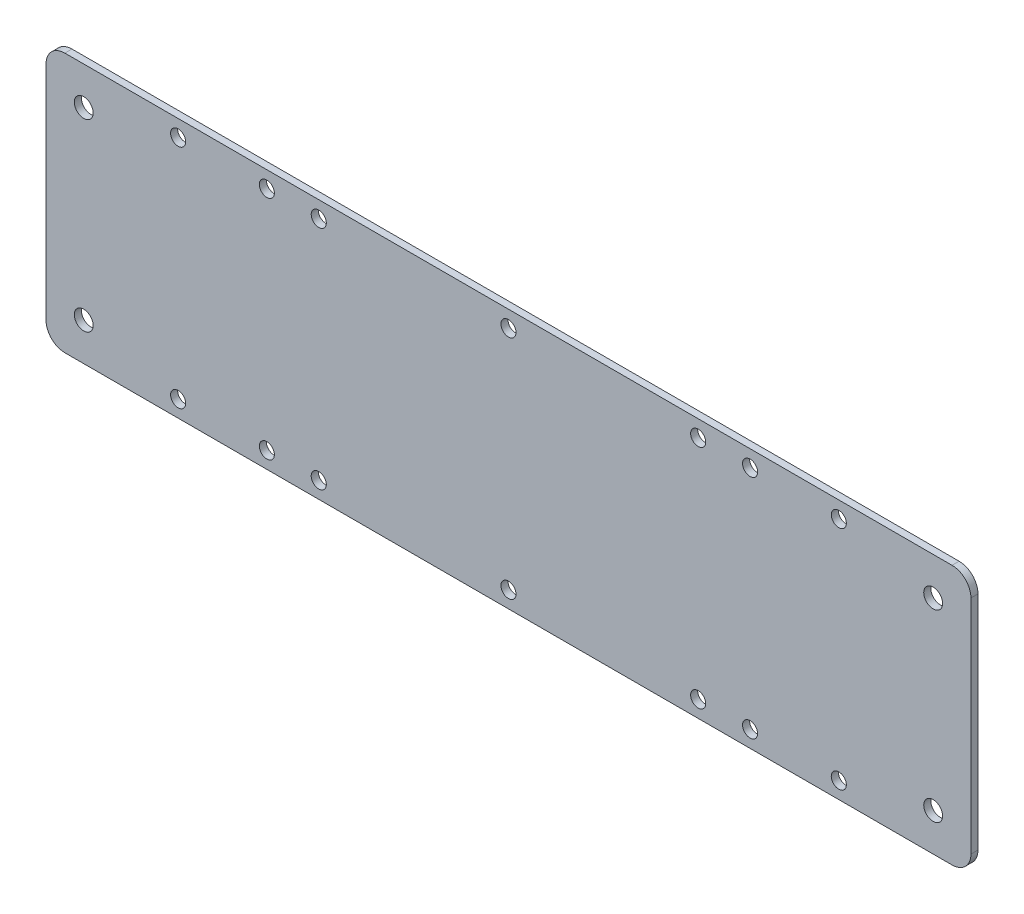
from build123d import *

# Parameters (mm, degrees)
ESQUISSE1_W             = 196
ESQUISSE1_H             = 55
BOSS_EXTRU_1_DEPTH      = 1.5
CONG_1_R                = 4
ESQUISSE2_R             = 2
ENL_V_MAT_EXTRU_1_DEPTH = 102.796365358
ENL_V_MAT_EXTRU_2_REACH = 103.796
ESQUISSE3_R             = 1.6
ENL_V_MAT_EXTRU_3_REACH = 103.796
ESQUISSE4_R             = 1.6


with BuildPart() as part:
    # Esquisse1 → Boss.-Extru.1 (new body)
    with BuildSketch(Plane.XY):
        Rectangle(ESQUISSE1_W, ESQUISSE1_H)
    extrude(amount=BOSS_EXTRU_1_DEPTH)

    # Congé1
    cong_1_edges = [part.edges().sort_by_distance(p)[0] for p in [
        (-98, 27.5, 0.75),
        (98, 27.5, 0.75),
        (98, -27.5, 0.75),
        (-98, -27.5, 0.75),
    ]]
    fillet(cong_1_edges, radius=CONG_1_R)

    # Esquisse2 → Enlèv. mat.-Extru.1 (cut, through all)
    with BuildSketch(Plane.XY.offset(1.5)):
        with Locations((-90, 19.5)):
            Circle(ESQUISSE2_R)
        with Locations((-90, -19.5)):
            Circle(ESQUISSE2_R)
        with Locations((90, 19.5)):
            Circle(ESQUISSE2_R)
        with Locations((90, -19.5)):
            Circle(ESQUISSE2_R)
    extrude(amount=-ENL_V_MAT_EXTRU_1_DEPTH, mode=Mode.SUBTRACT)

    # Esquisse3 → Enlèv. mat.-Extru.2 (cut, up to next)
    with BuildSketch(Plane.XY.offset(1.5), mode=Mode.PRIVATE) as enl_v_mat_extru_2_sk1:
        with Locations((-51.2, 24)):
            Circle(ESQUISSE3_R)
    enl_v_mat_extru_2_tool1 = extrude(enl_v_mat_extru_2_sk1.sketch, amount=-ENL_V_MAT_EXTRU_2_REACH, mode=Mode.PRIVATE) & part.part
    # Esquisse3 → Enlèv. mat.-Extru.2 (cut, up to next)
    with BuildSketch(Plane.XY.offset(1.5), mode=Mode.PRIVATE) as enl_v_mat_extru_2_sk2:
        with Locations((-40.2, 24)):
            Circle(ESQUISSE3_R)
    enl_v_mat_extru_2_tool2 = extrude(enl_v_mat_extru_2_sk2.sketch, amount=-ENL_V_MAT_EXTRU_2_REACH, mode=Mode.PRIVATE) & part.part
    # Esquisse3 → Enlèv. mat.-Extru.2 (cut, up to next)
    with BuildSketch(Plane.XY.offset(1.5), mode=Mode.PRIVATE) as enl_v_mat_extru_2_sk3:
        with Locations((-40.2, -24)):
            Circle(ESQUISSE3_R)
    enl_v_mat_extru_2_tool3 = extrude(enl_v_mat_extru_2_sk3.sketch, amount=-ENL_V_MAT_EXTRU_2_REACH, mode=Mode.PRIVATE) & part.part
    # Esquisse3 → Enlèv. mat.-Extru.2 (cut, up to next)
    with BuildSketch(Plane.XY.offset(1.5), mode=Mode.PRIVATE) as enl_v_mat_extru_2_sk4:
        with Locations((-51.2, -24)):
            Circle(ESQUISSE3_R)
    enl_v_mat_extru_2_tool4 = extrude(enl_v_mat_extru_2_sk4.sketch, amount=-ENL_V_MAT_EXTRU_2_REACH, mode=Mode.PRIVATE) & part.part
    # Esquisse3 → Enlèv. mat.-Extru.2 (cut, up to next)
    with BuildSketch(Plane.XY.offset(1.5), mode=Mode.PRIVATE) as enl_v_mat_extru_2_sk5:
        with Locations((40.2, -24)):
            Circle(ESQUISSE3_R)
    enl_v_mat_extru_2_tool5 = extrude(enl_v_mat_extru_2_sk5.sketch, amount=-ENL_V_MAT_EXTRU_2_REACH, mode=Mode.PRIVATE) & part.part
    # Esquisse3 → Enlèv. mat.-Extru.2 (cut, up to next)
    with BuildSketch(Plane.XY.offset(1.5), mode=Mode.PRIVATE) as enl_v_mat_extru_2_sk6:
        with Locations((51.2, -24)):
            Circle(ESQUISSE3_R)
    enl_v_mat_extru_2_tool6 = extrude(enl_v_mat_extru_2_sk6.sketch, amount=-ENL_V_MAT_EXTRU_2_REACH, mode=Mode.PRIVATE) & part.part
    # Esquisse3 → Enlèv. mat.-Extru.2 (cut, up to next)
    with BuildSketch(Plane.XY.offset(1.5), mode=Mode.PRIVATE) as enl_v_mat_extru_2_sk7:
        with Locations((51.2, 24)):
            Circle(ESQUISSE3_R)
    enl_v_mat_extru_2_tool7 = extrude(enl_v_mat_extru_2_sk7.sketch, amount=-ENL_V_MAT_EXTRU_2_REACH, mode=Mode.PRIVATE) & part.part
    # Esquisse3 → Enlèv. mat.-Extru.2 (cut, up to next)
    with BuildSketch(Plane.XY.offset(1.5), mode=Mode.PRIVATE) as enl_v_mat_extru_2_sk8:
        with Locations((40.2, 24)):
            Circle(ESQUISSE3_R)
    enl_v_mat_extru_2_tool8 = extrude(enl_v_mat_extru_2_sk8.sketch, amount=-ENL_V_MAT_EXTRU_2_REACH, mode=Mode.PRIVATE) & part.part
    add(enl_v_mat_extru_2_tool1.solids().sort_by_distance((-51.2, 24, 1.5))[0], mode=Mode.SUBTRACT)
    add(enl_v_mat_extru_2_tool2.solids().sort_by_distance((-40.2, 24, 1.5))[0], mode=Mode.SUBTRACT)
    add(enl_v_mat_extru_2_tool3.solids().sort_by_distance((-40.2, -24, 1.5))[0], mode=Mode.SUBTRACT)
    add(enl_v_mat_extru_2_tool4.solids().sort_by_distance((-51.2, -24, 1.5))[0], mode=Mode.SUBTRACT)
    add(enl_v_mat_extru_2_tool5.solids().sort_by_distance((40.2, -24, 1.5))[0], mode=Mode.SUBTRACT)
    add(enl_v_mat_extru_2_tool6.solids().sort_by_distance((51.2, -24, 1.5))[0], mode=Mode.SUBTRACT)
    add(enl_v_mat_extru_2_tool7.solids().sort_by_distance((51.2, 24, 1.5))[0], mode=Mode.SUBTRACT)
    add(enl_v_mat_extru_2_tool8.solids().sort_by_distance((40.2, 24, 1.5))[0], mode=Mode.SUBTRACT)

    # Esquisse4 → Enlèv. mat.-Extru.3 (cut, up to next)
    with BuildSketch(Plane.XY.offset(1.5), mode=Mode.PRIVATE) as enl_v_mat_extru_3_sk1:
        with Locations((-70, 24)):
            Circle(ESQUISSE4_R)
    enl_v_mat_extru_3_tool1 = extrude(enl_v_mat_extru_3_sk1.sketch, amount=-ENL_V_MAT_EXTRU_3_REACH, mode=Mode.PRIVATE) & part.part
    # Esquisse4 → Enlèv. mat.-Extru.3 (cut, up to next)
    with BuildSketch(Plane.XY.offset(1.5), mode=Mode.PRIVATE) as enl_v_mat_extru_3_sk2:
        with Locations((0, 24)):
            Circle(ESQUISSE4_R)
    enl_v_mat_extru_3_tool2 = extrude(enl_v_mat_extru_3_sk2.sketch, amount=-ENL_V_MAT_EXTRU_3_REACH, mode=Mode.PRIVATE) & part.part
    # Esquisse4 → Enlèv. mat.-Extru.3 (cut, up to next)
    with BuildSketch(Plane.XY.offset(1.5), mode=Mode.PRIVATE) as enl_v_mat_extru_3_sk3:
        with Locations((70, 24)):
            Circle(ESQUISSE4_R)
    enl_v_mat_extru_3_tool3 = extrude(enl_v_mat_extru_3_sk3.sketch, amount=-ENL_V_MAT_EXTRU_3_REACH, mode=Mode.PRIVATE) & part.part
    # Esquisse4 → Enlèv. mat.-Extru.3 (cut, up to next)
    with BuildSketch(Plane.XY.offset(1.5), mode=Mode.PRIVATE) as enl_v_mat_extru_3_sk4:
        with Locations((70, -24)):
            Circle(ESQUISSE4_R)
    enl_v_mat_extru_3_tool4 = extrude(enl_v_mat_extru_3_sk4.sketch, amount=-ENL_V_MAT_EXTRU_3_REACH, mode=Mode.PRIVATE) & part.part
    # Esquisse4 → Enlèv. mat.-Extru.3 (cut, up to next)
    with BuildSketch(Plane.XY.offset(1.5), mode=Mode.PRIVATE) as enl_v_mat_extru_3_sk5:
        with Locations((0, -24)):
            Circle(ESQUISSE4_R)
    enl_v_mat_extru_3_tool5 = extrude(enl_v_mat_extru_3_sk5.sketch, amount=-ENL_V_MAT_EXTRU_3_REACH, mode=Mode.PRIVATE) & part.part
    # Esquisse4 → Enlèv. mat.-Extru.3 (cut, up to next)
    with BuildSketch(Plane.XY.offset(1.5), mode=Mode.PRIVATE) as enl_v_mat_extru_3_sk6:
        with Locations((-70, -24)):
            Circle(ESQUISSE4_R)
    enl_v_mat_extru_3_tool6 = extrude(enl_v_mat_extru_3_sk6.sketch, amount=-ENL_V_MAT_EXTRU_3_REACH, mode=Mode.PRIVATE) & part.part
    add(enl_v_mat_extru_3_tool1.solids().sort_by_distance((-70, 24, 1.5))[0], mode=Mode.SUBTRACT)
    add(enl_v_mat_extru_3_tool2.solids().sort_by_distance((0, 24, 1.5))[0], mode=Mode.SUBTRACT)
    add(enl_v_mat_extru_3_tool3.solids().sort_by_distance((70, 24, 1.5))[0], mode=Mode.SUBTRACT)
    add(enl_v_mat_extru_3_tool4.solids().sort_by_distance((70, -24, 1.5))[0], mode=Mode.SUBTRACT)
    add(enl_v_mat_extru_3_tool5.solids().sort_by_distance((0, -24, 1.5))[0], mode=Mode.SUBTRACT)
    add(enl_v_mat_extru_3_tool6.solids().sort_by_distance((-70, -24, 1.5))[0], mode=Mode.SUBTRACT)


solid = part.part
